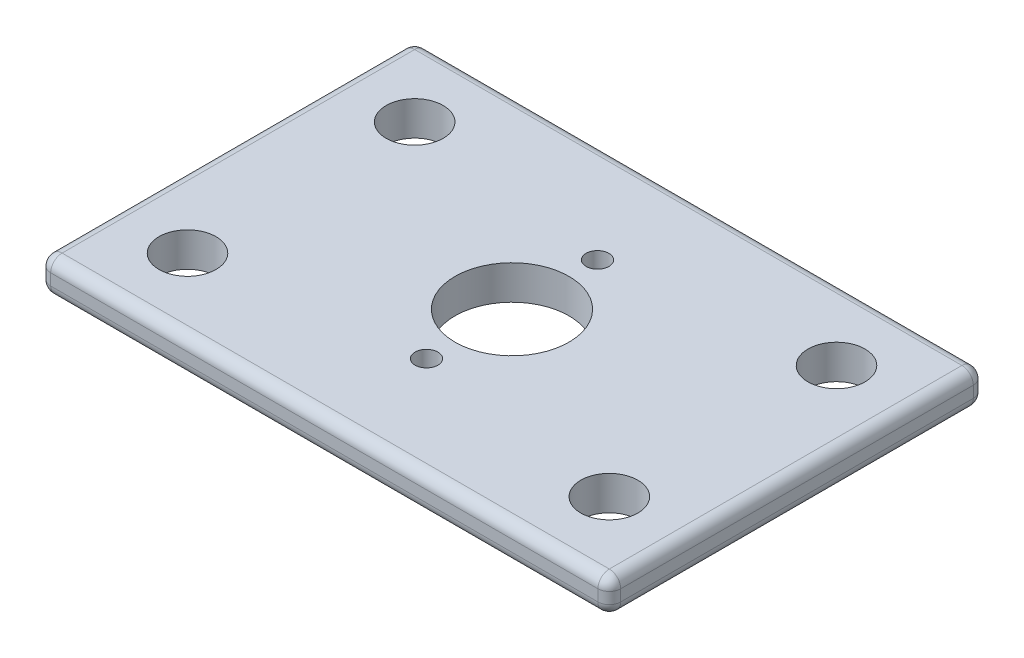
from build123d import *

# Parameters (mm, degrees)
SKETCH1_W           = 50
SKETCH1_H           = 32.926829268
BOSS_EXTRUDE1_DEPTH = 3
CUT_EXTRUDE1_REACH  = 61.943
SKETCH2_R           = 1
SKETCH2_R_2         = 5
CUT_EXTRUDE2_REACH  = 61.943
SKETCH3_R           = 2.5
FILLET1_R           = 1


with BuildPart() as part:
    # Sketch1 → Boss-Extrude1 (new body)
    with BuildSketch(Plane(origin=(0, 0, 0), x_dir=(1, 0, 0), z_dir=(0, 1, 0))):
        with Locations((25, 16.463414634)):
            Rectangle(SKETCH1_W, SKETCH1_H)
    extrude(amount=BOSS_EXTRUDE1_DEPTH)

    # Sketch2 → Cut-Extrude1 (cut, up to next)
    with BuildSketch(Plane(origin=(0, 3, 0), x_dir=(1, 0, 0), z_dir=(0, 1, 0)), mode=Mode.PRIVATE) as cut_extrude1_sk1:
        with Locations(Location((25, 8.963414634, 0), (0, 0, 270))):
            Circle(SKETCH2_R)
    cut_extrude1_tool1 = extrude(cut_extrude1_sk1.sketch, amount=-CUT_EXTRUDE1_REACH, mode=Mode.PRIVATE) & part.part
    # Sketch2 → Cut-Extrude1 (cut, up to next)
    with BuildSketch(Plane(origin=(0, 3, 0), x_dir=(1, 0, 0), z_dir=(0, 1, 0)), mode=Mode.PRIVATE) as cut_extrude1_sk2:
        with Locations(Location((25, 16.463414634, 0), (0, 0, 270))):
            Circle(SKETCH2_R_2)
    cut_extrude1_tool2 = extrude(cut_extrude1_sk2.sketch, amount=-CUT_EXTRUDE1_REACH, mode=Mode.PRIVATE) & part.part
    # Sketch2 → Cut-Extrude1 (cut, up to next)
    with BuildSketch(Plane(origin=(0, 3, 0), x_dir=(1, 0, 0), z_dir=(0, 1, 0)), mode=Mode.PRIVATE) as cut_extrude1_sk3:
        with Locations(Location((25, 23.963414634, 0), (0, 0, 270))):
            Circle(SKETCH2_R)
    cut_extrude1_tool3 = extrude(cut_extrude1_sk3.sketch, amount=-CUT_EXTRUDE1_REACH, mode=Mode.PRIVATE) & part.part
    add(cut_extrude1_tool1.solids().sort_by_distance((25, 3, -8.963415))[0], mode=Mode.SUBTRACT)
    add(cut_extrude1_tool2.solids().sort_by_distance((25, 3, -16.463415))[0], mode=Mode.SUBTRACT)
    add(cut_extrude1_tool3.solids().sort_by_distance((25, 3, -23.963415))[0], mode=Mode.SUBTRACT)

    # Sketch3 → Cut-Extrude2 (cut, up to next)
    with BuildSketch(Plane(origin=(0, 3, 0), x_dir=(1, 0, 0), z_dir=(0, 1, 0)), mode=Mode.PRIVATE) as cut_extrude2_sk1:
        with Locations(Location((43.5, 6.5, 0), (0, 0, 270))):
            Circle(SKETCH3_R)
    cut_extrude2_tool1 = extrude(cut_extrude2_sk1.sketch, amount=-CUT_EXTRUDE2_REACH, mode=Mode.PRIVATE) & part.part
    # Sketch3 → Cut-Extrude2 (cut, up to next)
    with BuildSketch(Plane(origin=(0, 3, 0), x_dir=(1, 0, 0), z_dir=(0, 1, 0)), mode=Mode.PRIVATE) as cut_extrude2_sk2:
        with Locations(Location((43.5, 26.426829268, 0), (0, 0, 270))):
            Circle(SKETCH3_R)
    cut_extrude2_tool2 = extrude(cut_extrude2_sk2.sketch, amount=-CUT_EXTRUDE2_REACH, mode=Mode.PRIVATE) & part.part
    # Sketch3 → Cut-Extrude2 (cut, up to next)
    with BuildSketch(Plane(origin=(0, 3, 0), x_dir=(1, 0, 0), z_dir=(0, 1, 0)), mode=Mode.PRIVATE) as cut_extrude2_sk3:
        with Locations(Location((6.5, 26.426829268, 0), (0, 0, 270))):
            Circle(SKETCH3_R)
    cut_extrude2_tool3 = extrude(cut_extrude2_sk3.sketch, amount=-CUT_EXTRUDE2_REACH, mode=Mode.PRIVATE) & part.part
    # Sketch3 → Cut-Extrude2 (cut, up to next)
    with BuildSketch(Plane(origin=(0, 3, 0), x_dir=(1, 0, 0), z_dir=(0, 1, 0)), mode=Mode.PRIVATE) as cut_extrude2_sk4:
        with Locations(Location((6.5, 6.5, 0), (0, 0, 270))):
            Circle(SKETCH3_R)
    cut_extrude2_tool4 = extrude(cut_extrude2_sk4.sketch, amount=-CUT_EXTRUDE2_REACH, mode=Mode.PRIVATE) & part.part
    add(cut_extrude2_tool1.solids().sort_by_distance((43.5, 3, -6.5))[0], mode=Mode.SUBTRACT)
    add(cut_extrude2_tool2.solids().sort_by_distance((43.5, 3, -26.426829))[0], mode=Mode.SUBTRACT)
    add(cut_extrude2_tool3.solids().sort_by_distance((6.5, 3, -26.426829))[0], mode=Mode.SUBTRACT)
    add(cut_extrude2_tool4.solids().sort_by_distance((6.5, 3, -6.5))[0], mode=Mode.SUBTRACT)

    # Fillet1
    fillet1_edges = [part.edges().sort_by_distance(p)[0] for p in [
        (50, 3, -16.463414634),
        (25, 3, -32.926829268),
        (0, 3, -16.463414634),
        (25, 0, -32.926829268),
        (50, 0, -16.463414634),
        (25, 0, 0),
        (0, 0, -16.463414634),
        (25, 3, 0),
        (0, 1.5, -32.926829268),
        (50, 1.5, -32.926829268),
        (50, 1.5, 0),
        (0, 1.5, 0),
    ]]
    fillet(fillet1_edges, radius=FILLET1_R)


solid = part.part
